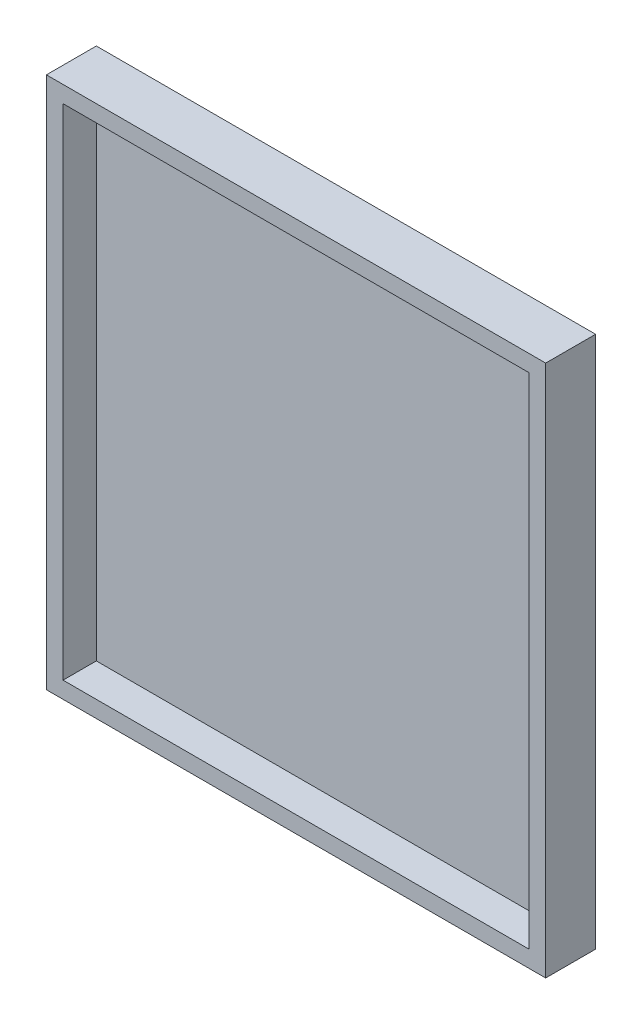
from build123d import *

# Parameters (mm, degrees)
SKETCH1_W           = 150
SKETCH1_H           = 160
BOSS_EXTRUDE1_DEPTH = 5
SKETCH2_W           = 150
SKETCH2_H           = 5
BOSS_EXTRUDE2_DEPTH = 10
SKETCH3_W           = 5
SKETCH3_H           = 155
BOSS_EXTRUDE3_DEPTH = 10
SKETCH4_W           = 145
SKETCH4_H           = 5
BOSS_EXTRUDE4_DEPTH = 10
SKETCH5_W           = 5
SKETCH5_H           = 150
BOSS_EXTRUDE5_DEPTH = 10


with BuildPart() as part:
    # Sketch1 → Boss-Extrude1 (new body)
    with BuildSketch(Plane.XY):
        with Locations((75, 80)):
            Rectangle(SKETCH1_W, SKETCH1_H)
    extrude(amount=-BOSS_EXTRUDE1_DEPTH)

    # Sketch2 → Boss-Extrude2 (add)
    with BuildSketch(Plane.XY):
        with Locations((75, 157.5)):
            Rectangle(SKETCH2_W, SKETCH2_H)
    extrude(amount=BOSS_EXTRUDE2_DEPTH)

    # Sketch3 → Boss-Extrude3 (add)
    with BuildSketch(Plane.XY):
        with Locations((147.5, 77.5)):
            Rectangle(SKETCH3_W, SKETCH3_H)
    extrude(amount=BOSS_EXTRUDE3_DEPTH)

    # Sketch4 → Boss-Extrude4 (add)
    with BuildSketch(Plane.XY):
        with Locations((72.5, 2.5)):
            Rectangle(SKETCH4_W, SKETCH4_H)
    extrude(amount=BOSS_EXTRUDE4_DEPTH)

    # Sketch5 → Boss-Extrude5 (add)
    with BuildSketch(Plane.XY):
        with Locations((2.5, 80)):
            Rectangle(SKETCH5_W, SKETCH5_H)
    extrude(amount=BOSS_EXTRUDE5_DEPTH)


solid = part.part
